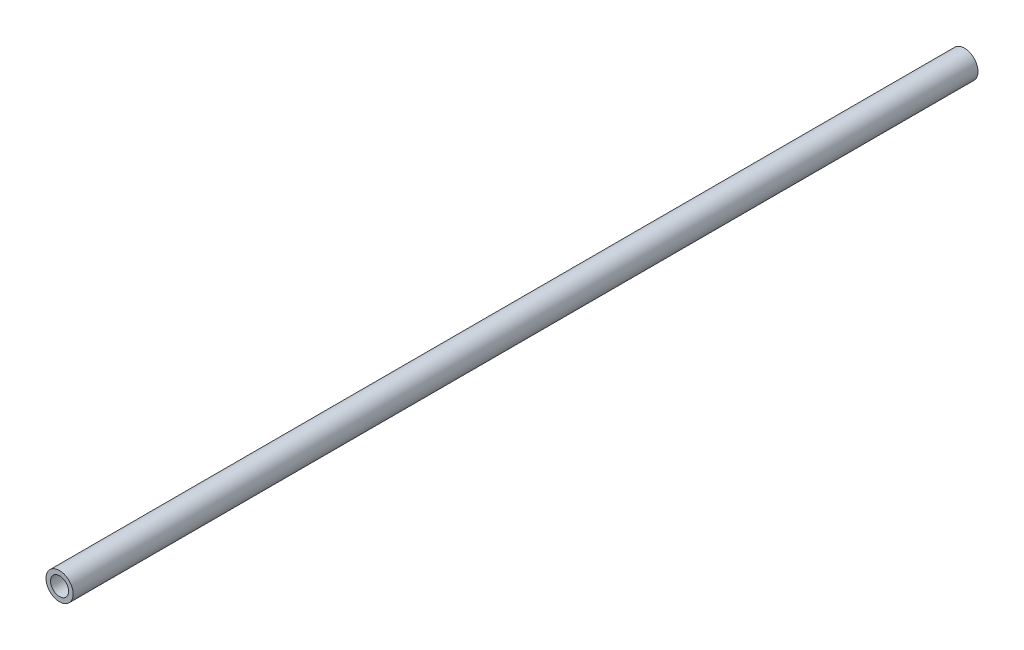
from build123d import *

# Parameters (mm, degrees)
SKETCH2_R           = 7.5
SKETCH2_R_2         = 5
BOSS_EXTRUDE1_DEPTH = 500


with BuildPart() as part:
    # Sketch2 → Boss-Extrude1 (new body)
    with BuildSketch(Plane.XY):
        Circle(SKETCH2_R)
        Circle(SKETCH2_R_2, mode=Mode.SUBTRACT)
    extrude(amount=BOSS_EXTRUDE1_DEPTH)


solid = part.part
